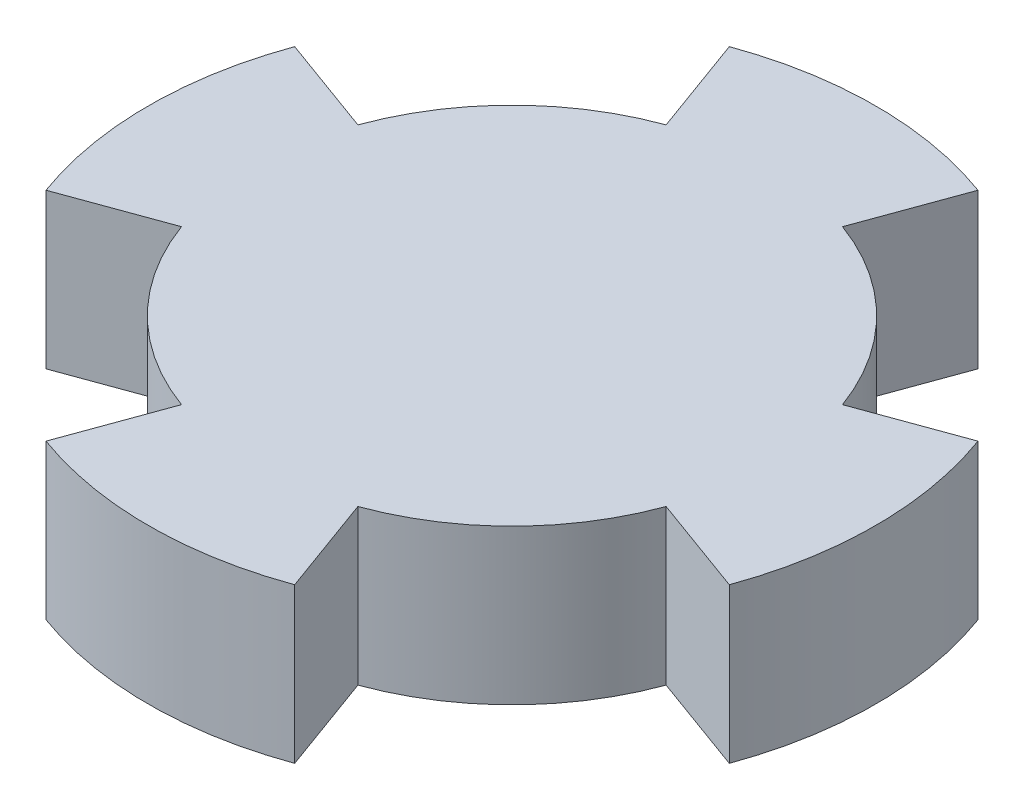
from build123d import *

# Parameters (mm, degrees)
EXTRUDE_1_DEPTH = 150


with BuildPart() as part:
    # 草图1 → 凸台-拉伸1 (new body)
    with BuildSketch(Plane(origin=(0, 0, 0), x_dir=(1, 0, 0), z_dir=(0, 1, 0))):
        with BuildLine():
            ThreePointArc((-120.562100522, -331.241648827), (-61.210982628, -347.144732937), (0, -352.5))
            ThreePointArc((0, -352.5), (61.210982628, -347.144732937), (120.562100522, -331.241648827))
            Line((120.562100522, -331.241648827), (85.505035831, -234.923155196))
            ThreePointArc((85.505035831, -234.923155196), (176.776695297, -176.776695297), (234.923155196, -85.505035831))
            Line((234.923155196, -85.505035831), (331.241648827, -120.562100522))
            ThreePointArc((331.241648827, -120.562100522), (347.144732937, -61.210982628), (352.5, 0))
            ThreePointArc((352.5, 0), (347.144732937, 61.210982628), (331.241648827, 120.562100522))
            Line((331.241648827, 120.562100522), (234.923155196, 85.505035831))
            ThreePointArc((234.923155196, 85.505035831), (176.776695297, 176.776695297), (85.505035831, 234.923155196))
            Line((85.505035831, 234.923155196), (120.562100522, 331.241648827))
            ThreePointArc((120.562100522, 331.241648827), (61.210982628, 347.144732937), (0, 352.5))
            ThreePointArc((0, 352.5), (-61.210982628, 347.144732937), (-120.562100522, 331.241648827))
            Line((-120.562100522, 331.241648827), (-85.505035831, 234.923155196))
            ThreePointArc((-85.505035831, 234.923155196), (-176.776695297, 176.776695297), (-234.923155196, 85.505035831))
            Line((-234.923155196, 85.505035831), (-331.241648827, 120.562100522))
            ThreePointArc((-331.241648827, 120.562100522), (-347.144732937, 61.210982628), (-352.5, 0))
            ThreePointArc((-352.5, 0), (-347.144732937, -61.210982628), (-331.241648827, -120.562100522))
            Line((-331.241648827, -120.562100522), (-234.923155196, -85.505035831))
            ThreePointArc((-234.923155196, -85.505035831), (-176.776695297, -176.776695297), (-85.505035831, -234.923155196))
            Line((-85.505035831, -234.923155196), (-120.562100522, -331.241648827))
        make_face()
    extrude(amount=EXTRUDE_1_DEPTH)


solid = part.part
